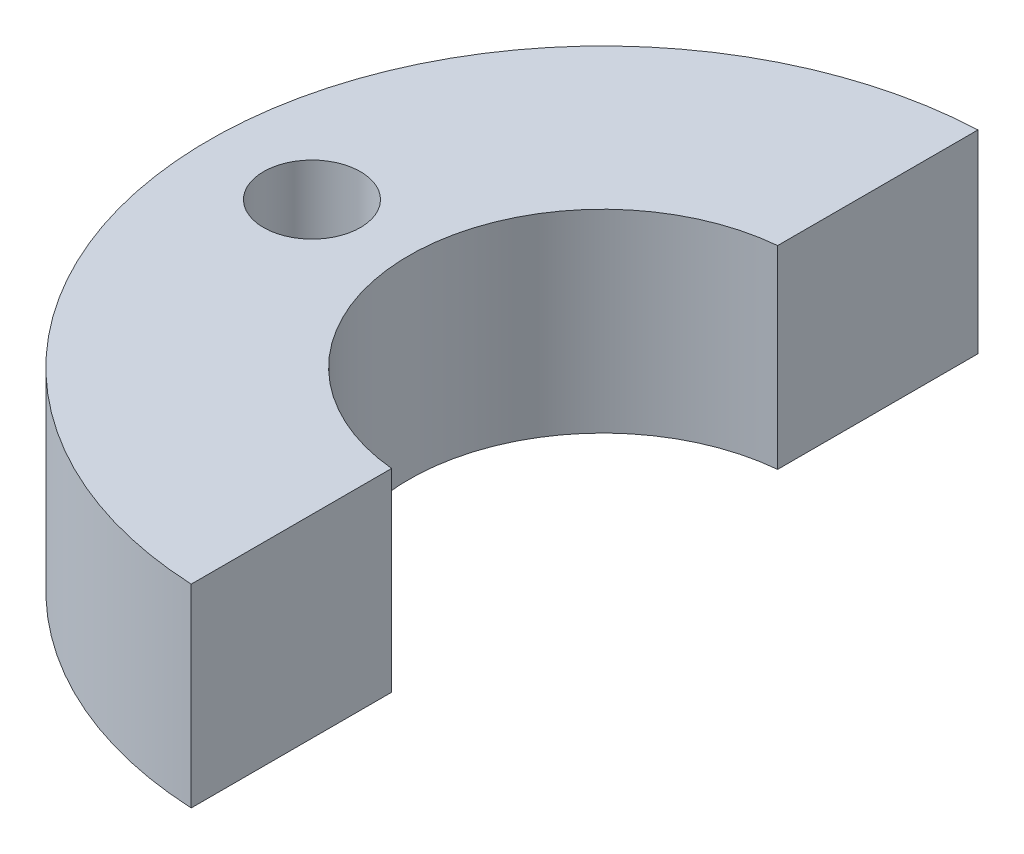
from build123d import *

# Parameters (mm, degrees)
SKETCH2_R           = 4
BOSS_EXTRUDE2_DEPTH = 8


with BuildPart() as part:
    # Sketch2 → Boss-Extrude2 (new, symmetric)
    with BuildSketch(Plane(origin=(0, 0, 0), x_dir=(1, 0, 0), z_dir=(0, 1, 0))):
        with BuildLine():
            Line((-1.5, 15.929532322), (-1.5, 32.465366161))
            ThreePointArc((-1.5, 32.465366161), (-32.5, 0), (-1.5, -32.465366161))
            Line((-1.5, -32.465366161), (-1.5, -15.929532322))
            ThreePointArc((-1.5, -15.929532322), (-16, 0), (-1.5, 15.929532322))
        make_face()
        with Locations(Location((-24, 0, 0), (0, 0, 270))):
            Circle(SKETCH2_R, mode=Mode.SUBTRACT)
    extrude(amount=BOSS_EXTRUDE2_DEPTH, both=True)


solid = part.part
